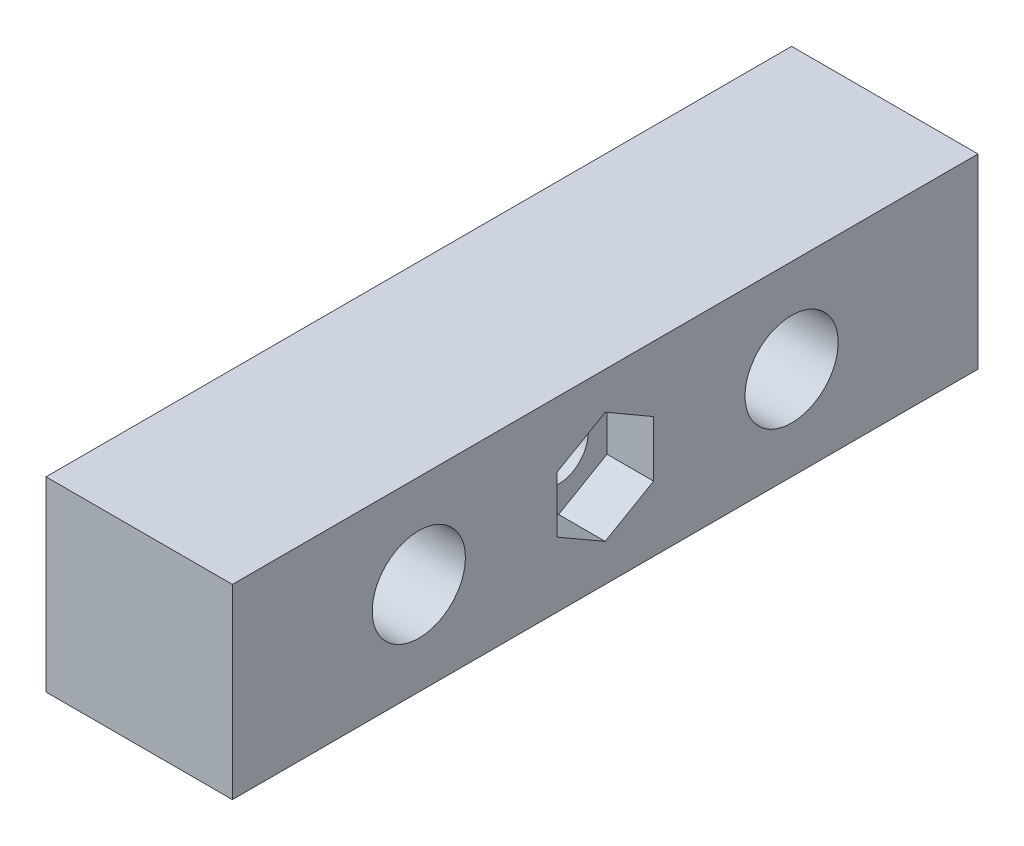
from build123d import *

# Parameters (mm, degrees)
SKETCH1_W           = 20
SKETCH1_H           = 80
BOSS_EXTRUDE1_DEPTH = 20
SKETCH2_R           = 5
CUT_EXTRUDE1_DEPTH  = 49.989794856
SKETCH5_R           = 3.175
CUT_EXTRUDE4_DEPTH  = 49.989794856
CUT_EXTRUDE3_DEPTH  = 5


with BuildPart() as part:
    # Sketch1 → Boss-Extrude1 (new body)
    with BuildSketch(Plane(origin=(0, 0, 0), x_dir=(1, 0, 0), z_dir=(0, 1, 0))):
        Rectangle(SKETCH1_W, SKETCH1_H)
    extrude(amount=BOSS_EXTRUDE1_DEPTH)

    # Sketch2 → Cut-Extrude1 (cut, through all)
    with BuildSketch(Plane(origin=(10, 0, 0), x_dir=(0, 0, -1), z_dir=(1, 0, 0))):
        with Locations((-20, 10)):
            Circle(SKETCH2_R)
        with Locations(Location((20, 10, 0), (0, 0, 180))):
            Circle(SKETCH2_R)
    extrude(amount=-CUT_EXTRUDE1_DEPTH, mode=Mode.SUBTRACT)

    # Sketch5 → Cut-Extrude4 (cut, through all)
    with BuildSketch(Plane(origin=(10, 0, 0), x_dir=(0, 0, -1), z_dir=(1, 0, 0))):
        with Locations((0, 10)):
            Circle(SKETCH5_R)
    extrude(amount=-CUT_EXTRUDE4_DEPTH, mode=Mode.SUBTRACT)

    # Sketch3 → Cut-Extrude3 (cut)
    with BuildSketch(Plane(origin=(10, 0, 0), x_dir=(0, 0, -1), z_dir=(1, 0, 0))):
        Polygon((0, 16), (-5.196152423, 13), (-5.196152423, 7), (0, 4), (5.196152423, 7), (5.196152423, 13), align=None)
    cut_extrude3 = extrude(amount=-CUT_EXTRUDE3_DEPTH, mode=Mode.SUBTRACT)

    # Mirror1: Cut-Extrude3 across plane
    add(cut_extrude3.mirror(Plane(origin=(0, 0, 0), x_dir=(0, 0, 1), z_dir=(1, 0, 0))), mode=Mode.SUBTRACT)


solid = part.part
